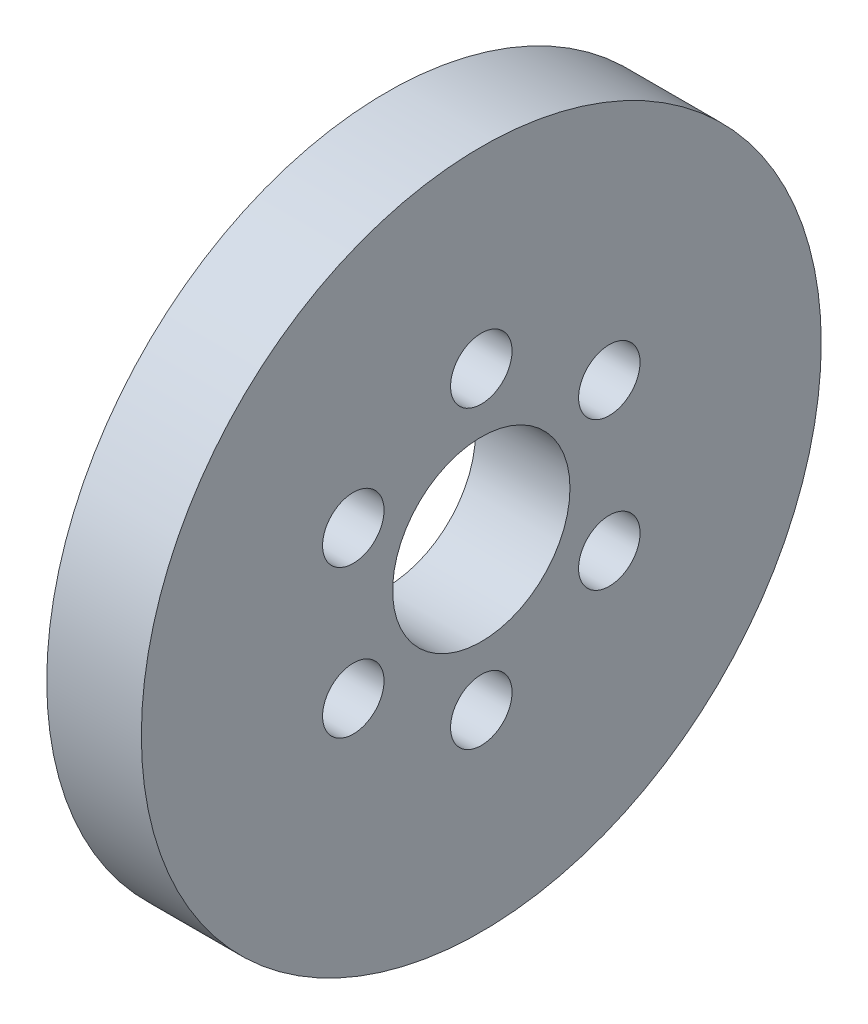
from build123d import *

# Parameters (mm, degrees)
SKETCH1_R                 = 18.25625
BOSS_EXTRUDE1_DEPTH       = 5.08
F_4_CLEARANCE_HOLE1_D     = 3.302
F_4_CLEARANCE_HOLE2_D     = 9.525
F_4_CLEARANCE_HOLE2_DEPTH = 57.15
F_4_CLEARANCE_HOLE2_TIP   = 2.861598698


with BuildPart() as part:
    # Sketch1 → Boss-Extrude1 (new body)
    with BuildSketch(Plane(origin=(0, 0, 0), x_dir=(0, 0, -1), z_dir=(1, 0, 0))):
        Circle(SKETCH1_R)
    extrude(amount=BOSS_EXTRUDE1_DEPTH)

    # #4 Clearance Hole1 (through all)
    with Locations(Plane(origin=(5.08, 0, 0), x_dir=(0, 0, -1), z_dir=(1, 0, 0))):
        with Locations((0, 7.9375), (6.874076643, 3.96875), (6.874076643, -3.96875), (0, -7.9375), (-6.874076643, -3.96875), (-6.874076643, 3.96875), (0, 0)):
            Hole(F_4_CLEARANCE_HOLE1_D / 2)

    # #4 Clearance Hole2
    with Locations(Plane(origin=(5.08, 0, 0), x_dir=(0, 0, -1), z_dir=(1, 0, 0))):
        with Locations((0, 0)):
            Hole(F_4_CLEARANCE_HOLE2_D / 2, depth=F_4_CLEARANCE_HOLE2_DEPTH)
            with Locations((0, 0, -(F_4_CLEARANCE_HOLE2_DEPTH + F_4_CLEARANCE_HOLE2_TIP / 2))):  # 118° drill point
                Cone(0, F_4_CLEARANCE_HOLE2_D / 2, F_4_CLEARANCE_HOLE2_TIP, mode=Mode.SUBTRACT)


solid = part.part
